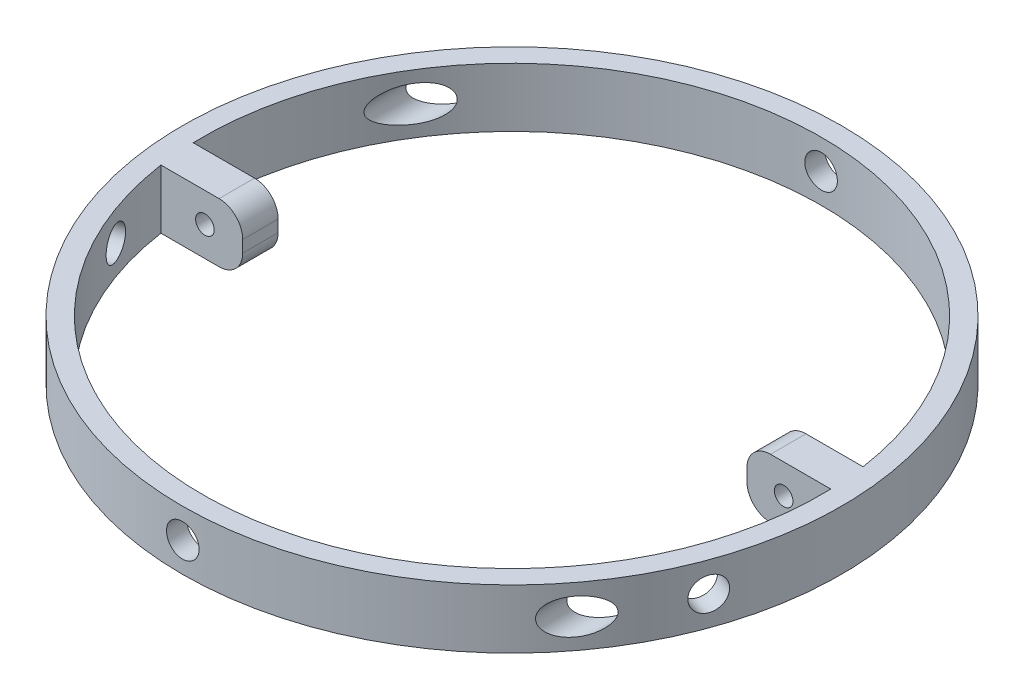
from build123d import *

# Parameters (mm, degrees)
SKETCH1_R                       = 35.433
SKETCH1_R_2                     = 33.274
BOSS_EXTRUDE1_DEPTH             = 6.35
BOSS_EXTRUDE2_START             = 1.016
SKETCH2_R                       = 1
BOSS_EXTRUDE2_DEPTH             = 3.81
BOSS_EXTRUDE3_DEPTH             = 0.00254
BOSS_EXTRUDE3_DEPTH_BACK        = 3.81
BOSS_EXTRUDE3_START             = -1.016
SKETCH3_R                       = 1
CUT_EXTRUDE1_START              = 27.94
SKETCH4_R                       = 1.7526
CUT_EXTRUDE1_DEPTH              = 17.272
CIRPATTERN1_COUNT               = 2
CIRPATTERN1_ANGLE               = 70
CIRPATTERN1_THE_OTHER_WAY_COUNT = 2
CIRPATTERN1_THE_OTHER_WAY_ANGLE = 70
CUT_EXTRUDE2_START              = -42.164
SKETCH5_R                       = 1.7526
CUT_EXTRUDE2_DEPTH              = 42.164
SKETCH6_R                       = 1.905
CUT_EXTRUDE3_DEPTH              = 40.386
SKETCH7_R                       = 1.905
CUT_EXTRUDE4_DEPTH              = 38.1


with BuildPart() as part:
    # Sketch1 → Boss-Extrude1 (new body)
    with BuildSketch(Plane(origin=(0, 0, 0.20701), x_dir=(1, 0, 0), z_dir=(0, 1, 0))):
        with Locations(Location((59.69, 0.20574, 0), (0, 0, 270))):
            Circle(SKETCH1_R)
        with Locations(Location((59.69, 0.20574, 0), (0, 0, 270))):
            Circle(SKETCH1_R_2, mode=Mode.SUBTRACT)
    extrude(amount=BOSS_EXTRUDE1_DEPTH)

    # Sketch2 → Boss-Extrude2 (add)
    with BuildSketch(Plane.XY.offset(BOSS_EXTRUDE2_START)):
        with BuildLine():
            Line((33.02, 6.35), (25.4, 6.35))
            Line((25.4, 6.35), (25.4, 0))
            Line((25.4, 0), (33.02, 0))
            ThreePointArc((33.02, 0), (34.816051224, 0.743948776), (35.56, 2.54))
            Line((35.56, 2.54), (35.56, 3.81))
            ThreePointArc((35.56, 3.81), (34.816051224, 5.606051224), (33.02, 6.35))
        make_face()
        with Locations(Location((31.496, 3.175, 0), (0, 0, 180))):
            Circle(SKETCH2_R, mode=Mode.SUBTRACT)
    extrude(amount=BOSS_EXTRUDE2_DEPTH)

    # Sketch3 → Boss-Extrude3 (add, two sides: drawn at the far end of the back side and taken through both)
    with BuildSketch(Plane.XY.offset(BOSS_EXTRUDE3_START - BOSS_EXTRUDE3_DEPTH_BACK)):
        with BuildLine():
            Line((93.98, 6.35), (86.469496204, 6.35))
            ThreePointArc((86.469496204, 6.35), (84.67344498, 5.606051224), (83.929496204, 3.81))
            Line((83.929496204, 3.81), (83.929496204, 2.54))
            ThreePointArc((83.929496204, 2.54), (84.67344498, 0.743948776), (86.469496204, 0))
            Line((86.469496204, 0), (93.98, 0))
            Line((93.98, 0), (93.98, 6.35))
        make_face()
        with Locations((87.884, 3.175)):
            Circle(SKETCH3_R, mode=Mode.SUBTRACT)
    extrude(amount=BOSS_EXTRUDE3_DEPTH + BOSS_EXTRUDE3_DEPTH_BACK)

    # Sketch4 → Cut-Extrude1 (cut)
    with BuildSketch(Plane.XY.offset(CUT_EXTRUDE1_START)):
        with Locations((59.69, 3.175)):
            Circle(SKETCH4_R)
    cut_extrude1 = extrude(amount=CUT_EXTRUDE1_DEPTH, mode=Mode.SUBTRACT)

    # CirPattern1: Cut-Extrude1 ×2 about axis
    cirpattern1_axis = Axis((59.69, 0, 0.00127), (0, -1, 0))
    for i in range(1, CIRPATTERN1_COUNT):
        add(cut_extrude1.rotate(cirpattern1_axis, i * CIRPATTERN1_ANGLE / (CIRPATTERN1_COUNT - 1)), mode=Mode.SUBTRACT)

    # CirPattern1 the other way: Cut-Extrude1 ×2 about axis
    cirpattern1_the_other_way_axis = Axis((59.69, 0, 0.00127), (0, 1, 0))
    for i in range(1, CIRPATTERN1_THE_OTHER_WAY_COUNT):
        add(cut_extrude1.rotate(cirpattern1_the_other_way_axis, i * CIRPATTERN1_THE_OTHER_WAY_ANGLE / (CIRPATTERN1_THE_OTHER_WAY_COUNT - 1)), mode=Mode.SUBTRACT)

    # Sketch5 → Cut-Extrude2 (cut)
    with BuildSketch(Plane.XY.offset(CUT_EXTRUDE2_START)):
        with Locations((59.69, 3.175)):
            Circle(SKETCH5_R)
    extrude(amount=CUT_EXTRUDE2_DEPTH, mode=Mode.SUBTRACT)

    # Sketch6 → Cut-Extrude3 (cut)
    with BuildSketch(Plane.XY.offset(-1.01346)):
        with Locations(Location((87.884, 3.175, 0), (0, 0, 180))):
            Circle(SKETCH6_R)
    extrude(amount=CUT_EXTRUDE3_DEPTH, mode=Mode.SUBTRACT)

    # Sketch7 → Cut-Extrude4 (cut)
    with BuildSketch(Plane(origin=(0, 0, 1.016), x_dir=(-1, 0, 0), z_dir=(0, 0, -1))):
        with Locations(Location((-31.496, 3.175, 0), (0, 0, 180))):
            Circle(SKETCH7_R)
    extrude(amount=CUT_EXTRUDE4_DEPTH, mode=Mode.SUBTRACT)


solid = part.part
